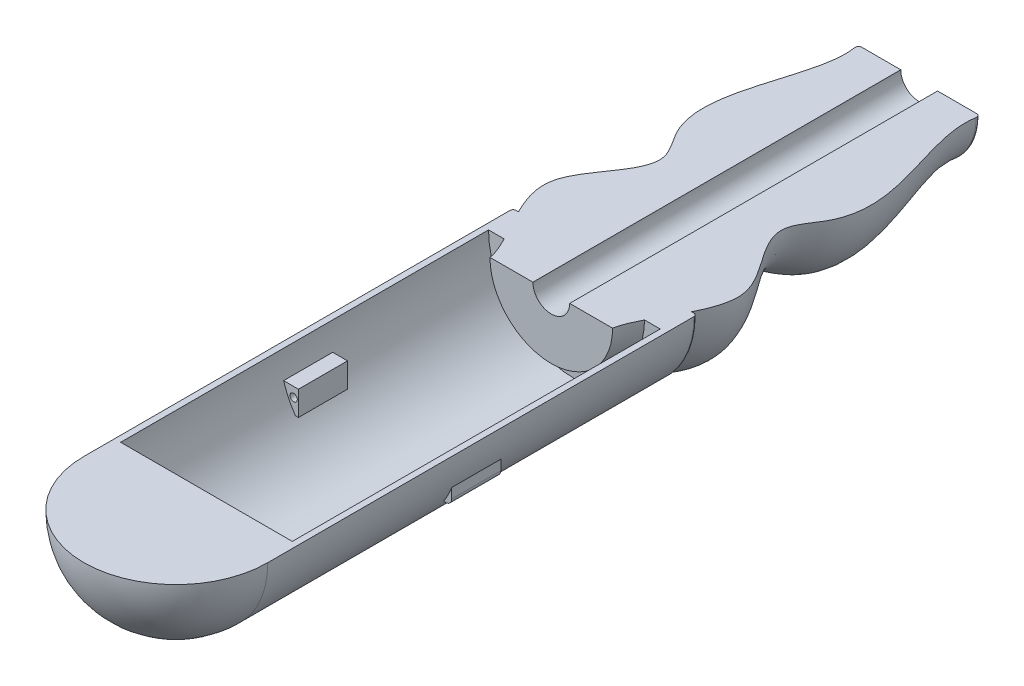
from build123d import *

# Parameters (mm, degrees)
SKETCH1_R           = 38.1
BOSS_EXTRUDE1_DEPTH = 177.80000000000007
SKETCH3_R           = 35.559999999999995
CUT_EXTRUDE1_DEPTH  = 152.4
FILLET2_R           = 1.27
FILLET3_R           = 1.27
SKETCH9_R           = 7.62
CUT_EXTRUDE2_DEPTH  = 165.1
SKETCH8_W           = 162.58314194957535
SKETCH8_H           = 382.9318112434521
CUT_EXTRUDE3_DEPTH  = 76.2
BOSS_EXTRUDE2_DEPTH = 7.619999999999988
SKETCH14_R          = 1.5239999999999987
CUT_EXTRUDE4_DEPTH  = 22.859999999999992
FILLET5_R           = 2.539999999999999
BOSS_EXTRUDE3_DEPTH = 7.619999999999988
FILLET6_R           = 2.539999999999999
SKETCH16_R          = 1.524000000000002
CUT_EXTRUDE5_DEPTH  = 22.859999999999992


with BuildPart() as part:
    # Sketch1 → Boss-Extrude1 (new body)
    with BuildSketch(Plane.XY):
        with Locations(Location((0, 0, 0), (0, 0, 180))):
            Circle(SKETCH1_R)
    extrude(amount=BOSS_EXTRUDE1_DEPTH)

    # Sketch2 → Revolve1 (revolve)
    with BuildSketch(Plane.XY.offset(177.80000000000007)):
        with BuildLine():
            Line((0, 38.1), (0, -38.1))
            ThreePointArc((0, -38.1), (-38.1, 4.67e-15), (0, 38.1))
        make_face()
    revolve(axis=Axis((0, 38.1, 177.80000000000007), (0, -1, 0)))

    # Sketch3 → Cut-Extrude1 (cut)
    with BuildSketch(Plane(origin=(0, 0, 12.7), x_dir=(-1, 0, 0), z_dir=(0, 0, -1))):
        Circle(SKETCH3_R)
    extrude(amount=-CUT_EXTRUDE1_DEPTH, mode=Mode.SUBTRACT)

    # Sketch6 → Revolve2 (revolve)
    with BuildSketch(Plane(origin=(0, 0, 0), x_dir=(-1, 0, 0), z_dir=(0, -1, 0))):
        with BuildLine():
            Line((0, -22.265951698074105), (0, 130.1340483019259))
            Line((0, 130.1340483019259), (-25.4, 130.1340483019259))
            add(Edge.make_bspline(
                [(-25.4, -22.265951698074105), (-27.209474215272646, -11.435886390625324), (-47.26531015507889, 9.698536893320565), (-32.8781656152221, 32.20916869017141), (-21.12597121495262, 47.868344338725585), (-46.9742504639721, 77.09905148430619), (-20.88415964856982, 111.24461293700098), (-25.4, 130.1340483019259)],
                knots=[0, 0, 0, 0, 0.261326759387534, 0.3596065034464086, 0.4835247043674423, 0.5659559263177129, 1, 1, 1, 1], degree=3))
            Line((-25.4, -22.265951698074105), (0, -22.265951698074105))
        make_face()
    revolve(axis=Axis((0, 0, 22.265951698074105), (0, 0, -1)))

    # Fillet2
    fillet2_edges = [part.edges().sort_by_distance(p)[0] for p in [
        (38.1, -9.33e-15, 0),
    ]]
    fillet(fillet2_edges, radius=FILLET2_R)

    # Fillet3
    fillet3_edges = [part.edges().sort_by_distance(p)[0] for p in [
        (-25.4, -3.11e-15, -130.1340483019259),
    ]]
    fillet(fillet3_edges, radius=FILLET3_R)

    # Sketch9 → Cut-Extrude2 (cut)
    with BuildSketch(Plane(origin=(0, 0, -130.1340483019259), x_dir=(-1, 0, 0), z_dir=(0, 0, -1))):
        Circle(SKETCH9_R)
    extrude(amount=-CUT_EXTRUDE2_DEPTH, mode=Mode.SUBTRACT)

    # Sketch8 → Cut-Extrude3 (cut)
    with BuildSketch(Plane(origin=(0, 0, 0), x_dir=(-1, 0, 0), z_dir=(0, -1, 0))):
        with Locations((4.054997145320982, -34.07619336508105)):
            Rectangle(SKETCH8_W, SKETCH8_H)
    extrude(amount=-CUT_EXTRUDE3_DEPTH, mode=Mode.SUBTRACT)

    # Sketch13 → Boss-Extrude2 (add)
    with BuildSketch(Plane(origin=(-35.559999999999995, 0, 0), x_dir=(0, 0, -1), z_dir=(1, 0, 0))):
        Polygon((-88.89999999999999, -10.159999999999995), (-99.06, -10.159999999999997), (-99.06, -20.319999999999997), (-78.74, -20.319999999999997), (-78.74, -10.159999999999995), align=None)
    extrude(amount=BOSS_EXTRUDE2_DEPTH)

    # Sketch14 → Cut-Extrude4 (cut)
    with BuildSketch(Plane(origin=(0, 0, 78.74), x_dir=(-1, 0, 0), z_dir=(0, 0, -1))):
        with Locations((29.94604004289414, -14.16356154450682)):
            Circle(SKETCH14_R)
    extrude(amount=-CUT_EXTRUDE4_DEPTH, mode=Mode.SUBTRACT)

    # Fillet5
    fillet5_edges = [part.edges().sort_by_distance(p)[0] for p in [
        (-35.559999999999995, -20.319999999999997, 88.9),
    ]]
    fillet(fillet5_edges, radius=FILLET5_R)

    # Sketch15 → Boss-Extrude3 (add)
    with BuildSketch(Plane.ZY.offset(-35.55999999999999)):
        Polygon((88.89999999999999, -10.159999999999995), (78.74, -10.159999999999997), (78.74, -20.319999999999997), (99.06, -20.319999999999997), (99.06, -10.159999999999995), align=None)
    extrude(amount=BOSS_EXTRUDE3_DEPTH)

    # Fillet6
    fillet6_edges = [part.edges().sort_by_distance(p)[0] for p in [
        (35.55999999999999, -20.319999999999997, 88.9),
    ]]
    fillet(fillet6_edges, radius=FILLET6_R)

    # Sketch16 → Cut-Extrude5 (cut)
    with BuildSketch(Plane(origin=(0, 0, 78.74), x_dir=(-1, 0, 0), z_dir=(0, 0, -1))):
        with Locations((-30.332583398218205, -13.54198617207203)):
            Circle(SKETCH16_R)
    extrude(amount=-CUT_EXTRUDE5_DEPTH, mode=Mode.SUBTRACT)


solid = part.part
